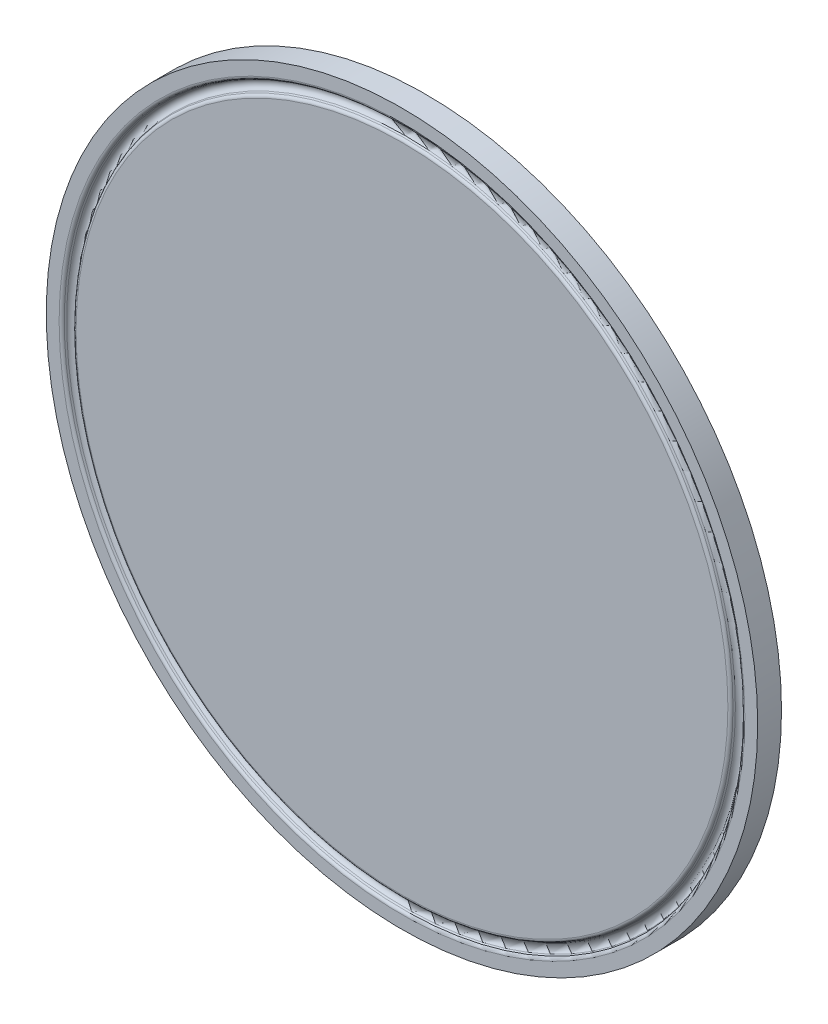
from build123d import *


with BuildPart() as part:
    # Sketch1 → Revolve1 (revolve)
    with BuildSketch(Plane(origin=(0, 0, 0), x_dir=(0, 0, -1), z_dir=(1, 0, 0)), mode=Mode.PRIVATE) as revolve1_sk:
        with BuildLine():
            Line((0, 0), (0, 76.444627725))
            ThreePointArc((0, 76.444627725), (0.130798304, 76.879222907), (0.479738309, 77.169433247))
            Line((0.479738309, 77.169433247), (0.872854821, 77.336301306))
            ThreePointArc((0.872854821, 77.336301306), (1.6002, 78.4352), (0.872854821, 79.534098694))
            Line((0.872854821, 79.534098694), (0.479738309, 79.700966753))
            ThreePointArc((0.479738309, 79.700966753), (0.130798304, 79.991177093), (0, 80.425772275))
            Line((0, 80.425772275), (0, 83.439))
            Line((0, 83.439), (5.588, 83.439))
            Line((5.588, 83.439), (11.0998, 68.295453959))
            Line((11.0998, 68.295453959), (11.0998, 0))
            Line((11.0998, 0), (0, 0))
        make_face()
    revolve(revolve1_sk.sketch.rotate(Axis((0, 0, 0), (0, 0, -1)), 90), axis=Axis((0, 0, 0), (0, 0, -1)))


solid = part.part
